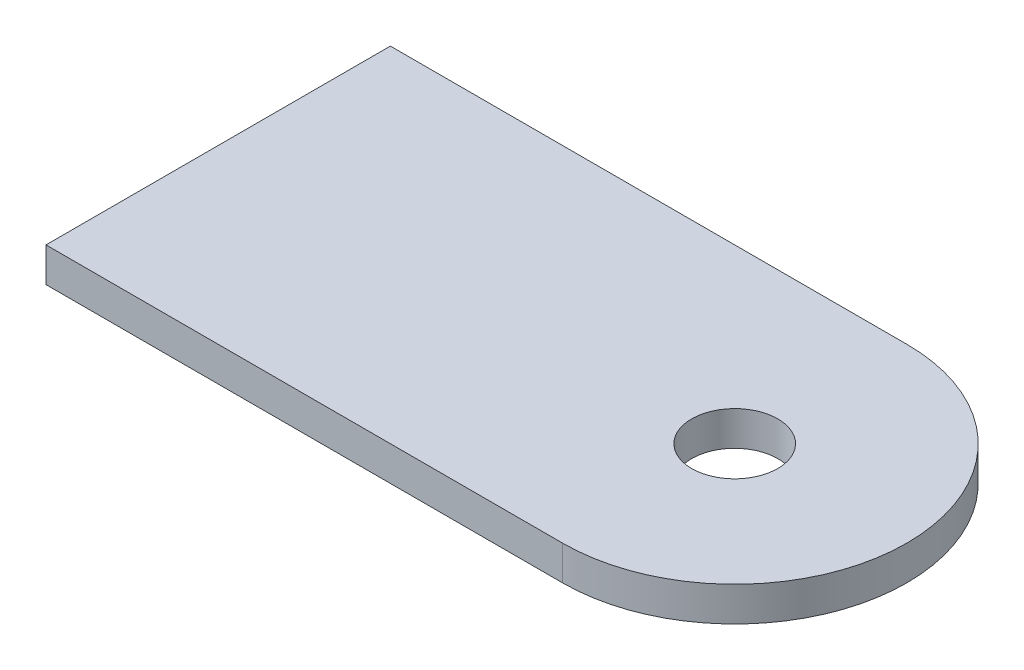
from build123d import *

# Parameters (mm, degrees)
SKETCH1_R           = 5
SKETCH1_W           = 40
SKETCH1_H           = 40
BOSS_EXTRUDE1_DEPTH = 4


with BuildPart() as part:
    # Sketch1 → Boss-Extrude1 (new body)
    # profile 1 of 2: a face of its own
    with BuildSketch(Plane(origin=(0, 0, 0), x_dir=(1, 0, 0), z_dir=(0, 1, 0))):
        with BuildLine():
            ThreePointArc((60, 40), (80, 20), (60, 0))
            Line((60, 0), (40, 0))
            Line((40, 0), (40, 40))
            Line((40, 40), (60, 40))
        make_face()
        with Locations(Location((60, 20, 0), (0, 0, 270))):
            Circle(SKETCH1_R, mode=Mode.SUBTRACT)
    # profile 2 of 2: a face of its own
    with BuildSketch(Plane(origin=(0, 0, 0), x_dir=(1, 0, 0), z_dir=(0, 1, 0))):
        with Locations((20, 20)):
            Rectangle(SKETCH1_W, SKETCH1_H)
    extrude(amount=BOSS_EXTRUDE1_DEPTH)


solid = part.part
